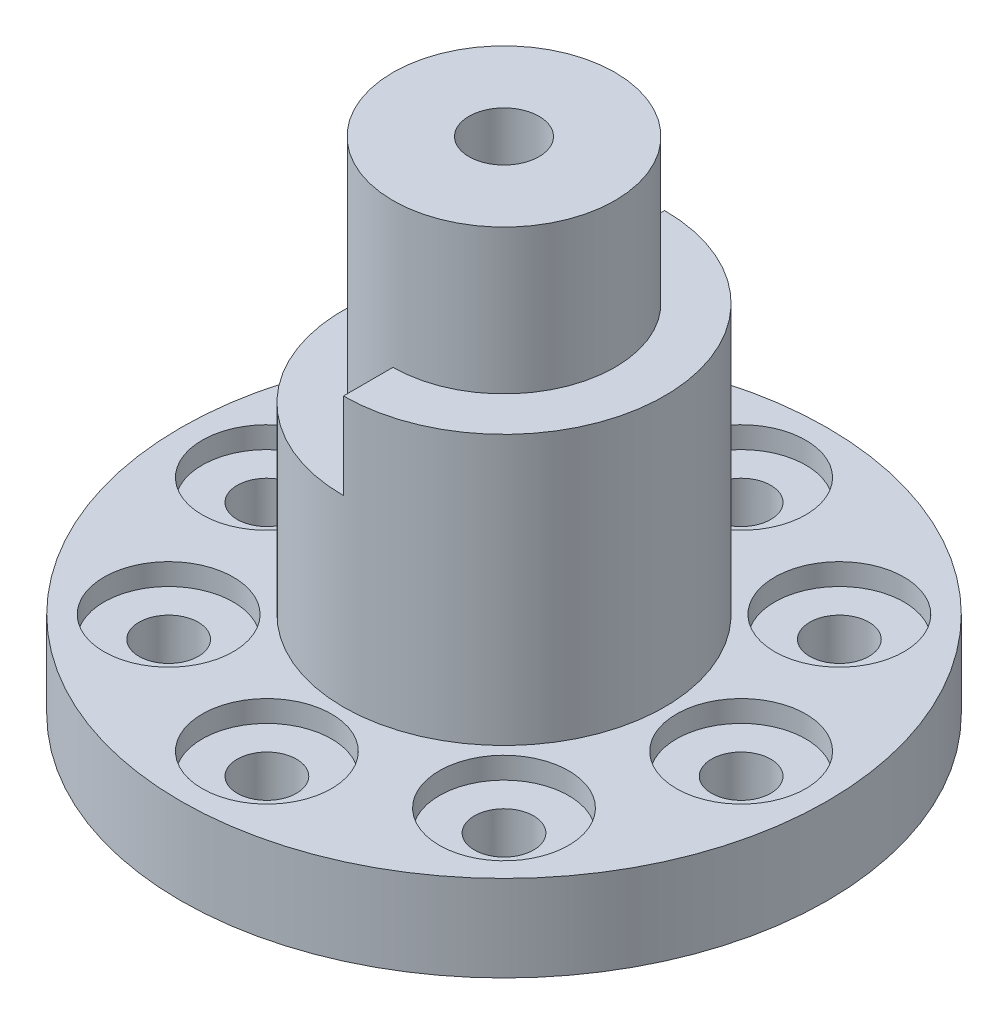
from build123d import *

# Parameters (mm, degrees)
SKETCH1_R           = 7.5
BOSS_EXTRUDE1_DEPTH = 5
SKETCH1_3_R         = 5.15
BOSS_EXTRUDE2_DEPTH = 15.7
BOSS_EXTRUDE3_DEPTH = 4
SKETCH3_R           = 1.625
CUT_EXTRUDE1_DEPTH  = 37
SKETCH4_R           = 3.5
CUT_EXTRUDE2_DEPTH  = 10.7
BOSS_EXTRUDE4_START = 3.5
SKETCH5_R           = 7.5
SKETCH5_R_2         = 3.5
BOSS_EXTRUDE4_DEPTH = 3.5
BOSS_EXTRUDE5_START = 4
SKETCH6_R           = 15
SKETCH6_R_2         = 1.375
SKETCH6_R_3         = 3.5
BOSS_EXTRUDE5_DEPTH = 4
SKETCH7_R           = 3
CUT_EXTRUDE3_DEPTH  = 1
CUT_EXTRUDE4_START  = -12.5
SKETCH8_R           = 7.5
SKETCH8_R_2         = 7.45
CUT_EXTRUDE4_DEPTH  = 12.5


with BuildPart() as part:
    # Sketch1 → Boss-Extrude1 (new body)
    with BuildSketch(Plane(origin=(0, 0, 0), x_dir=(1, 0, 0), z_dir=(0, 1, 0))):
        Circle(SKETCH1_R)
    extrude(amount=BOSS_EXTRUDE1_DEPTH)

    # Sketch1<3> → Boss-Extrude2 (add)
    with BuildSketch(Plane(origin=(0, 0, 0), x_dir=(1, 0, 0), z_dir=(0, 1, 0))):
        Circle(SKETCH1_3_R)
    extrude(amount=BOSS_EXTRUDE2_DEPTH)

    # Sketch2 → Boss-Extrude3 (add)
    with BuildSketch(Plane(origin=(0, 5, 0), x_dir=(1, 0, 0), z_dir=(0, 1, 0))):
        with BuildLine():
            ThreePointArc((7.5, 0), (5.303300859, 5.303300859), (0, 7.5))
            Line((0, 7.5), (0, 5.15))
            ThreePointArc((0, 5.15), (3.641599923, 3.641599923), (5.15, 0))
            ThreePointArc((5.15, 0), (3.641599923, -3.641599923), (0, -5.15))
            Line((0, -5.15), (0, -7.5))
            ThreePointArc((0, -7.5), (5.303300859, -5.303300859), (7.5, 0))
        make_face()
    extrude(amount=BOSS_EXTRUDE3_DEPTH)

    # Sketch3 → Cut-Extrude1 (cut)
    with BuildSketch(Plane.XZ):
        Circle(SKETCH3_R)
    extrude(amount=-CUT_EXTRUDE1_DEPTH, mode=Mode.SUBTRACT)

    # Sketch4 → Cut-Extrude2 (cut)
    with BuildSketch(Plane.XZ):
        Circle(SKETCH4_R)
    extrude(amount=-CUT_EXTRUDE2_DEPTH, mode=Mode.SUBTRACT)

    # Sketch5 → Boss-Extrude4 (add)
    with BuildSketch(Plane.XZ.offset(BOSS_EXTRUDE4_START)):
        Circle(SKETCH5_R)
        Circle(SKETCH5_R_2, mode=Mode.SUBTRACT)
    extrude(amount=-BOSS_EXTRUDE4_DEPTH)

    # Sketch6 → Boss-Extrude5 (add)
    with BuildSketch(Plane.XZ.offset(3.5).offset(BOSS_EXTRUDE5_START)):
        Circle(SKETCH6_R)
        with Locations((11, 0)):
            Circle(SKETCH6_R_2, mode=Mode.SUBTRACT)
        with Locations((7.778174593, -7.778174593)):
            Circle(SKETCH6_R_2, mode=Mode.SUBTRACT)
        with Locations((0, -11)):
            Circle(SKETCH6_R_2, mode=Mode.SUBTRACT)
        with Locations((-7.778174593, -7.778174593)):
            Circle(SKETCH6_R_2, mode=Mode.SUBTRACT)
        with Locations((-11, 0)):
            Circle(SKETCH6_R_2, mode=Mode.SUBTRACT)
        with Locations((-7.778174593, 7.778174593)):
            Circle(SKETCH6_R_2, mode=Mode.SUBTRACT)
        with Locations((0, 11)):
            Circle(SKETCH6_R_2, mode=Mode.SUBTRACT)
        with Locations((7.778174593, 7.778174593)):
            Circle(SKETCH6_R_2, mode=Mode.SUBTRACT)
        Circle(SKETCH6_R_3, mode=Mode.SUBTRACT)
    extrude(amount=-BOSS_EXTRUDE5_DEPTH)

    # Sketch7 → Cut-Extrude3 (cut)
    with BuildSketch(Plane(origin=(0, -3.5, 0), x_dir=(1, 0, 0), z_dir=(0, 1, 0))):
        with Locations((-11, 0)):
            Circle(SKETCH7_R)
        with Locations((-7.778174593, 7.778174593)):
            Circle(SKETCH7_R)
        with Locations((0, 11)):
            Circle(SKETCH7_R)
        with Locations((7.778174593, 7.778174593)):
            Circle(SKETCH7_R)
        with Locations((11, 0)):
            Circle(SKETCH7_R)
        with Locations((7.778174593, -7.778174593)):
            Circle(SKETCH7_R)
        with Locations((0, -11)):
            Circle(SKETCH7_R)
        with Locations((-7.778174593, -7.778174593)):
            Circle(SKETCH7_R)
    extrude(amount=-CUT_EXTRUDE3_DEPTH, mode=Mode.SUBTRACT)

    # Sketch8 → Cut-Extrude4 (cut)
    with BuildSketch(Plane(origin=(0, 9, 0), x_dir=(1, 0, 0), z_dir=(0, 1, 0)).offset(CUT_EXTRUDE4_START)):
        Circle(SKETCH8_R)
        Circle(SKETCH8_R_2, mode=Mode.SUBTRACT)
    extrude(amount=CUT_EXTRUDE4_DEPTH, mode=Mode.SUBTRACT)


solid = part.part
